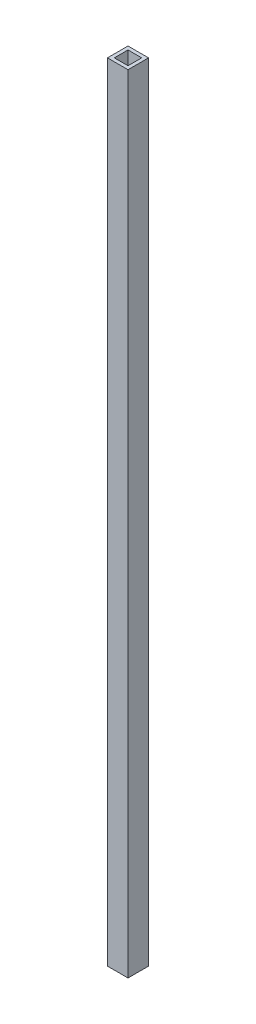
from build123d import *

# Parameters (mm, degrees)
SKETCH1_W           = 19.05
SKETCH1_H           = 19.05
SKETCH1_W_2         = 12.7
SKETCH1_H_2         = 12.7
EXTRUDE_THIN1_DEPTH = 730.25


with BuildPart() as part:
    # Sketch1 → Extrude-Thin1 (new body)
    with BuildSketch(Plane(origin=(0, 0, 0), x_dir=(1, 0, 0), z_dir=(0, 1, 0))):
        with Locations((9.525, 9.525)):
            Rectangle(SKETCH1_W, SKETCH1_H)
        with Locations((9.525, 9.525)):
            Rectangle(SKETCH1_W_2, SKETCH1_H_2, mode=Mode.SUBTRACT)
    extrude(amount=EXTRUDE_THIN1_DEPTH)


solid = part.part
